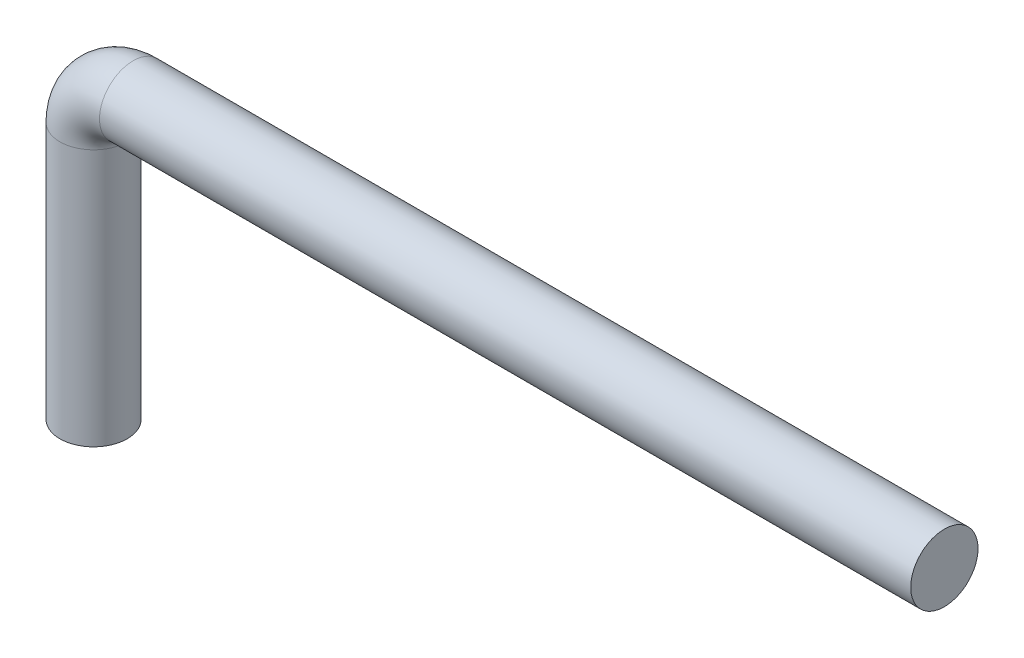
from build123d import *

# Parameters (mm, degrees)
SKETCH3_R = 10.795


with BuildPart() as part:
    # Sweep1: sweep along a path in Sketch2
    with BuildLine(Plane.XY) as sweep1_path:
        Line((0, 0), (-260.35, 0))
        ThreePointArc((-260.35, 0), (-269.330256121, -3.719743879), (-273.05, -12.7))
        Line((-273.05, -12.7), (-273.05, -95.25))
    # Sketch3 → Sweep1 (sweep)
    with BuildSketch(Plane(origin=(0, 0, 0), x_dir=(0, 0, -1), z_dir=(1, 0, 0))):
        Circle(SKETCH3_R)
    sweep(path=sweep1_path.line)


solid = part.part
